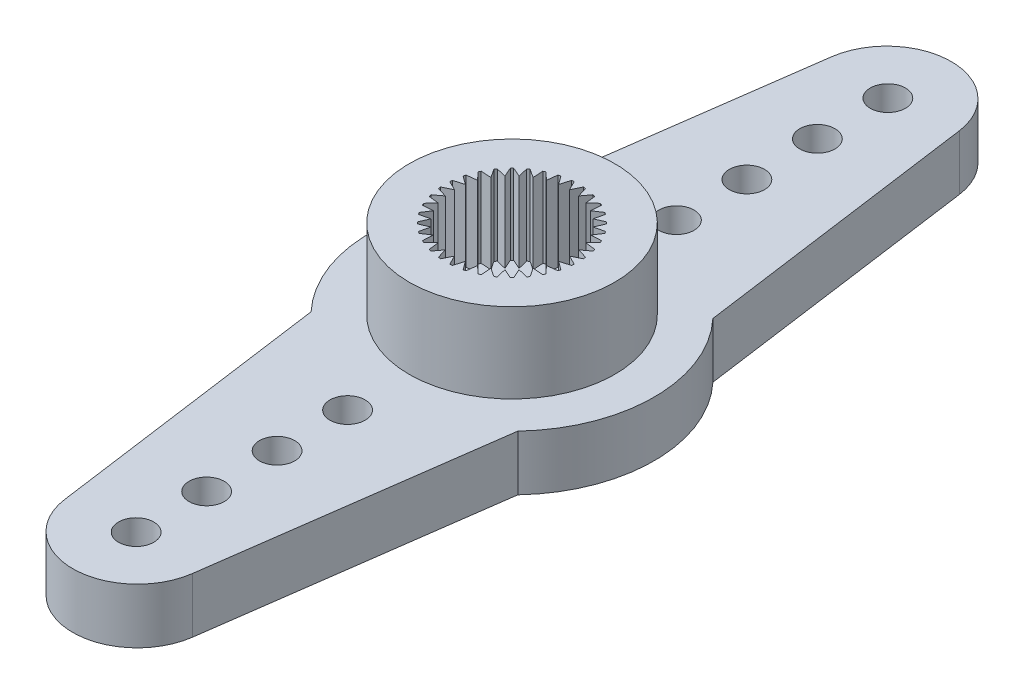
from build123d import *

# Parameters (mm, degrees)
BOSS_EXTRUDE1_DEPTH                                = 2.35
SKETCH2_R                                          = 4.375
BOSS_EXTRUDE2_DEPTH                                = 3.4
CUT_EXTRUDE1_DEPTH                                 = 3.4
F_8_8_8_8_DIAMETER_HOLE1_D                         = 8.8
F_8_8_8_8_DIAMETER_HOLE1_DEPTH                     = 0.3
SKETCH6_W                                          = 3.25
SKETCH6_H                                          = 0.3
F_1_5_1_5_DIAMETER_HOLE1_D                         = 1.5
CBORE_FOR_M2_5_HEX_HEAD_MACHINE_SCREW1_D           = 3
CBORE_FOR_M2_5_HEX_HEAD_MACHINE_SCREW1_DEPTH       = 5.75
CBORE_FOR_M2_5_HEX_HEAD_MACHINE_SCREW1_CBORE_D     = 5.5
CBORE_FOR_M2_5_HEX_HEAD_MACHINE_SCREW1_CBORE_DEPTH = 0.3


with BuildPart() as part:
    # Sketch1 → Boss-Extrude1 (new body)
    with BuildSketch(Plane(origin=(0, 2.35, 0), x_dir=(1, 0, 0), z_dir=(0, 1, 0))):
        with BuildLine():
            Line((2.724307673, -16.32503027), (4.4, -4.152408939))
            ThreePointArc((4.4, -4.152408939), (6.05, 0), (4.4, 4.152408939))
            Line((4.4, 4.152408939), (2.724307673, 16.32503027))
            ThreePointArc((2.724307673, 16.32503027), (0, 18.7), (-2.724307673, 16.32503027))
            Line((-2.724307673, 16.32503027), (-4.4, 4.152408939))
            ThreePointArc((-4.4, 4.152408939), (-6.05, 0), (-4.4, -4.152408939))
            Line((-4.4, -4.152408939), (-2.724307673, -16.32503027))
            ThreePointArc((-2.724307673, -16.32503027), (0, -18.7), (2.724307673, -16.32503027))
        make_face()
    extrude(amount=-BOSS_EXTRUDE1_DEPTH)

    # Sketch2 → Boss-Extrude2 (add)
    with BuildSketch(Plane(origin=(0, 2.35, 0), x_dir=(-1, 0, 0), z_dir=(0, 1, 0))):
        with Locations(Location((0, 0, 0), (0, 0, 90))):
            Circle(SKETCH2_R)
    extrude(amount=BOSS_EXTRUDE2_DEPTH)

    # Sketch3 → Cut-Extrude1 (cut)
    with BuildSketch(Plane(origin=(0, 5.75, 0), x_dir=(-1, 0, 0), z_dir=(0, 1, 0))):
        with BuildLine():
            Line((0.687336745, 2.765875666), (0.425438035, 2.412778995))
            Line((0.425438035, 2.412778995), (0.300099924, 2.834155965))
            ThreePointArc((0.300099924, 2.834155965), (0.248393867, 2.83915489), (0.196605286, 2.843210573))
            Line((0.196605286, 2.843210573), (0, 2.45))
            Line((0, 2.45), (-0.196605286, 2.843210573))
            ThreePointArc((-0.196605286, 2.843210573), (-0.248393867, 2.83915489), (-0.300099924, 2.834155965))
            Line((-0.300099924, 2.834155965), (-0.425438035, 2.412778995))
            Line((-0.425438035, 2.412778995), (-0.687336745, 2.765875666))
            ThreePointArc((-0.687336745, 2.765875666), (-0.737634279, 2.752888605), (-0.787686751, 2.738986963))
            Line((-0.787686751, 2.738986963), (-0.837949351, 2.302246921))
            Line((-0.837949351, 2.302246921), (-1.157183824, 2.604501026))
            ThreePointArc((-1.157183824, 2.604501026), (-1.204462046, 2.582977193), (-1.251340114, 2.560595228))
            Line((-1.251340114, 2.560595228), (-1.225, 2.121762239))
            Line((-1.225, 2.121762239), (-1.591870459, 2.363989941))
            ThreePointArc((-1.591870459, 2.363989941), (-1.634692844, 2.334583326), (-1.676972141, 2.304401102))
            Line((-1.676972141, 2.304401102), (-1.574829644, 1.876808886))
            Line((-1.574829644, 1.876808886), (-1.978188915, 2.051650218))
            ThreePointArc((-1.978188915, 2.051650218), (-2.015254326, 2.015254326), (-2.051650218, 1.978188915))
            Line((-2.051650218, 1.978188915), (-1.876808886, 1.574829644))
            Line((-1.876808886, 1.574829644), (-2.304401102, 1.676972141))
            ThreePointArc((-2.304401102, 1.676972141), (-2.334583326, 1.634692844), (-2.363989941, 1.591870459))
            Line((-2.363989941, 1.591870459), (-2.121762239, 1.225))
            Line((-2.121762239, 1.225), (-2.560595228, 1.251340114))
            ThreePointArc((-2.560595228, 1.251340114), (-2.582977193, 1.204462046), (-2.604501026, 1.157183824))
            Line((-2.604501026, 1.157183824), (-2.302246921, 0.837949351))
            Line((-2.302246921, 0.837949351), (-2.738986963, 0.787686751))
            ThreePointArc((-2.738986963, 0.787686751), (-2.752888605, 0.737634279), (-2.765875666, 0.687336745))
            Line((-2.765875666, 0.687336745), (-2.412778995, 0.425438035))
            Line((-2.412778995, 0.425438035), (-2.834155965, 0.300099924))
            ThreePointArc((-2.834155965, 0.300099924), (-2.83915489, 0.248393867), (-2.843210573, 0.196605286))
            Line((-2.843210573, 0.196605286), (-2.45, 0))
            Line((-2.45, 0), (-2.843210573, -0.196605286))
            ThreePointArc((-2.843210573, -0.196605286), (-2.83915489, -0.248393867), (-2.834155965, -0.300099924))
            Line((-2.834155965, -0.300099924), (-2.412778995, -0.425438035))
            Line((-2.412778995, -0.425438035), (-2.765875666, -0.687336745))
            ThreePointArc((-2.765875666, -0.687336745), (-2.752888605, -0.737634279), (-2.738986963, -0.787686751))
            Line((-2.738986963, -0.787686751), (-2.302246921, -0.837949351))
            Line((-2.302246921, -0.837949351), (-2.604501026, -1.157183824))
            ThreePointArc((-2.604501026, -1.157183824), (-2.582977193, -1.204462046), (-2.560595228, -1.251340114))
            Line((-2.560595228, -1.251340114), (-2.121762239, -1.225))
            Line((-2.121762239, -1.225), (-2.363989941, -1.591870459))
            ThreePointArc((-2.363989941, -1.591870459), (-2.334583326, -1.634692844), (-2.304401102, -1.676972141))
            Line((-2.304401102, -1.676972141), (-1.876808886, -1.574829644))
            Line((-1.876808886, -1.574829644), (-2.051650218, -1.978188915))
            ThreePointArc((-2.051650218, -1.978188915), (-2.015254326, -2.015254326), (-1.978188915, -2.051650218))
            Line((-1.978188915, -2.051650218), (-1.574829644, -1.876808886))
            Line((-1.574829644, -1.876808886), (-1.676972141, -2.304401102))
            ThreePointArc((-1.676972141, -2.304401102), (-1.634692844, -2.334583326), (-1.591870459, -2.363989941))
            Line((-1.591870459, -2.363989941), (-1.225, -2.121762239))
            Line((-1.225, -2.121762239), (-1.251340114, -2.560595228))
            ThreePointArc((-1.251340114, -2.560595228), (-1.204462046, -2.582977193), (-1.157183824, -2.604501026))
            Line((-1.157183824, -2.604501026), (-0.837949351, -2.302246921))
            Line((-0.837949351, -2.302246921), (-0.787686751, -2.738986963))
            ThreePointArc((-0.787686751, -2.738986963), (-0.737634279, -2.752888605), (-0.687336745, -2.765875666))
            Line((-0.687336745, -2.765875666), (-0.425438035, -2.412778995))
            Line((-0.425438035, -2.412778995), (-0.300099924, -2.834155965))
            ThreePointArc((-0.300099924, -2.834155965), (-0.248393867, -2.83915489), (-0.196605286, -2.843210573))
            Line((-0.196605286, -2.843210573), (0, -2.45))
            Line((0, -2.45), (0.196605286, -2.843210573))
            ThreePointArc((0.196605286, -2.843210573), (0.248393867, -2.83915489), (0.300099924, -2.834155965))
            Line((0.300099924, -2.834155965), (0.425438035, -2.412778995))
            Line((0.425438035, -2.412778995), (0.687336745, -2.765875666))
            ThreePointArc((0.687336745, -2.765875666), (0.737634279, -2.752888605), (0.787686751, -2.738986963))
            Line((0.787686751, -2.738986963), (0.837949351, -2.302246921))
            Line((0.837949351, -2.302246921), (1.157183824, -2.604501026))
            ThreePointArc((1.157183824, -2.604501026), (1.204462046, -2.582977193), (1.251340114, -2.560595228))
            Line((1.251340114, -2.560595228), (1.225, -2.121762239))
            Line((1.225, -2.121762239), (1.591870459, -2.363989941))
            ThreePointArc((1.591870459, -2.363989941), (1.634692844, -2.334583326), (1.676972141, -2.304401102))
            Line((1.676972141, -2.304401102), (1.574829644, -1.876808886))
            Line((1.574829644, -1.876808886), (1.978188915, -2.051650218))
            ThreePointArc((1.978188915, -2.051650218), (2.015254326, -2.015254326), (2.051650218, -1.978188915))
            Line((2.051650218, -1.978188915), (1.876808886, -1.574829644))
            Line((1.876808886, -1.574829644), (2.304401102, -1.676972141))
            ThreePointArc((2.304401102, -1.676972141), (2.334583326, -1.634692844), (2.363989941, -1.591870459))
            Line((2.363989941, -1.591870459), (2.121762239, -1.225))
            Line((2.121762239, -1.225), (2.560595228, -1.251340114))
            ThreePointArc((2.560595228, -1.251340114), (2.582977193, -1.204462046), (2.604501026, -1.157183824))
            Line((2.604501026, -1.157183824), (2.302246921, -0.837949351))
            Line((2.302246921, -0.837949351), (2.738986963, -0.787686751))
            ThreePointArc((2.738986963, -0.787686751), (2.752888605, -0.737634279), (2.765875666, -0.687336745))
            Line((2.765875666, -0.687336745), (2.412778995, -0.425438035))
            Line((2.412778995, -0.425438035), (2.834155965, -0.300099924))
            ThreePointArc((2.834155965, -0.300099924), (2.83915489, -0.248393867), (2.843210573, -0.196605286))
            Line((2.843210573, -0.196605286), (2.45, 0))
            Line((2.45, 0), (2.843210573, 0.196605286))
            ThreePointArc((2.843210573, 0.196605286), (2.83915489, 0.248393867), (2.834155965, 0.300099924))
            Line((2.834155965, 0.300099924), (2.412778995, 0.425438035))
            Line((2.412778995, 0.425438035), (2.765875666, 0.687336745))
            ThreePointArc((2.765875666, 0.687336745), (2.752888605, 0.737634279), (2.738986963, 0.787686751))
            Line((2.738986963, 0.787686751), (2.302246921, 0.837949351))
            Line((2.302246921, 0.837949351), (2.604501026, 1.157183824))
            ThreePointArc((2.604501026, 1.157183824), (2.582977193, 1.204462046), (2.560595228, 1.251340114))
            Line((2.560595228, 1.251340114), (2.121762239, 1.225))
            Line((2.121762239, 1.225), (2.363989941, 1.591870459))
            ThreePointArc((2.363989941, 1.591870459), (2.334583326, 1.634692844), (2.304401102, 1.676972141))
            Line((2.304401102, 1.676972141), (1.876808886, 1.574829644))
            Line((1.876808886, 1.574829644), (2.051650218, 1.978188915))
            ThreePointArc((2.051650218, 1.978188915), (2.015254326, 2.015254326), (1.978188915, 2.051650218))
            Line((1.978188915, 2.051650218), (1.574829644, 1.876808886))
            Line((1.574829644, 1.876808886), (1.676972141, 2.304401102))
            ThreePointArc((1.676972141, 2.304401102), (1.634692844, 2.334583326), (1.591870459, 2.363989941))
            Line((1.591870459, 2.363989941), (1.225, 2.121762239))
            Line((1.225, 2.121762239), (1.251340114, 2.560595228))
            ThreePointArc((1.251340114, 2.560595228), (1.204462046, 2.582977193), (1.157183824, 2.604501026))
            Line((1.157183824, 2.604501026), (0.837949351, 2.302246921))
            Line((0.837949351, 2.302246921), (0.787686751, 2.738986963))
            ThreePointArc((0.787686751, 2.738986963), (0.737634279, 2.752888605), (0.687336745, 2.765875666))
        make_face()
    extrude(amount=-CUT_EXTRUDE1_DEPTH, mode=Mode.SUBTRACT)

    # Ø8.8 (8.8) Diameter Hole1
    with Locations(Plane(origin=(0, 0, 0), x_dir=(-1, 0, 0), z_dir=(0, -1, 0))):
        with Locations((0, 0)):
            Hole(F_8_8_8_8_DIAMETER_HOLE1_D / 2, depth=F_8_8_8_8_DIAMETER_HOLE1_DEPTH)

    # Sketch6 → Revolve1 (revolve)
    with BuildSketch(Plane.XY, mode=Mode.PRIVATE) as revolve1_sk:
        with Locations((1.625, 0.15)):
            Rectangle(SKETCH6_W, SKETCH6_H)
    revolve(revolve1_sk.sketch.rotate(Axis((0, 0.3, 0), (0, -1, 0)), 270), axis=Axis((0, 0.3, 0), (0, -1, 0)))

    # Ø1.5 (1.5) Diameter Hole1 (through all)
    with Locations(Plane(origin=(0, 2.35, 0), x_dir=(1, 0, 0), z_dir=(0, 1, 0))):
        with Locations((0, -7), (0, 16), (0, -10), (0, -13), (0, -16), (0, 13), (0, 10), (0, 7)):
            Hole(F_1_5_1_5_DIAMETER_HOLE1_D / 2)

    # CBORE for M2.5 Hex Head Machine Screw1
    with Locations(Plane(origin=(0, 0, 0), x_dir=(-1, 0, 0), z_dir=(0, -1, 0))):
        with Locations((0, 0)):
            CounterBoreHole(CBORE_FOR_M2_5_HEX_HEAD_MACHINE_SCREW1_D / 2, CBORE_FOR_M2_5_HEX_HEAD_MACHINE_SCREW1_CBORE_D / 2, CBORE_FOR_M2_5_HEX_HEAD_MACHINE_SCREW1_CBORE_DEPTH, depth=CBORE_FOR_M2_5_HEX_HEAD_MACHINE_SCREW1_DEPTH)


solid = part.part
